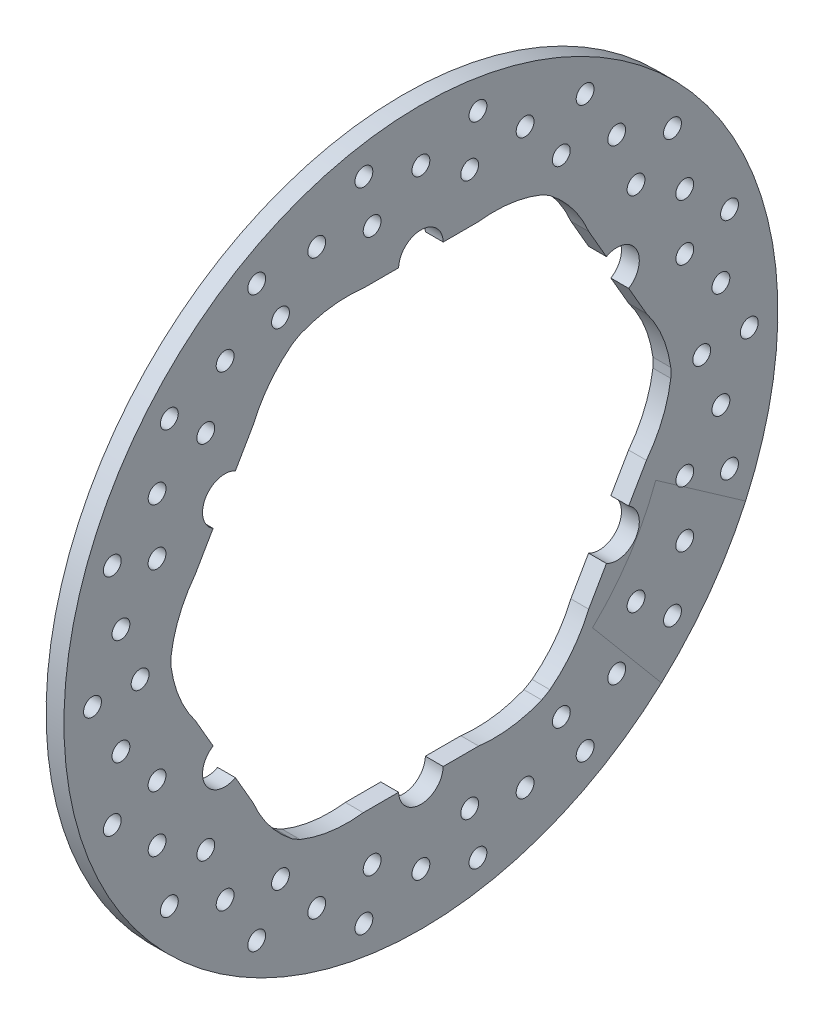
from build123d import *

# Parameters (mm, degrees)
SKETCH1_R           = 95.25
SKETCH1_R_2         = 66.675
MAIN_ROTOR_DEPTH    = 4.7625
SKETCH2_R           = 2.38125
CUT_SLOTS_DEPTH     = 135.788005424
BOSS_EXTRUDE2_START = -4.7625
BOSS_EXTRUDE2_DEPTH = 4.7625
SKETCH4_R           = 1.27
CUT_EXTRUDE2_DEPTH  = 135.788005424
FE12_CUT_OUT_DEPTH  = 4.7625
CIRPATTERN1_COUNT   = 6
SKETCH7_R           = 46.99
CLEANUP_CUT_DEPTH   = 135.788005424


with BuildPart() as part:
    # Sketch1 → Main Rotor (new body)
    with BuildSketch(Plane(origin=(0, 0, 0), x_dir=(0, 0, -1), z_dir=(1, 0, 0))):
        with Locations(Location((0, 0, 0), (0, 0, 180))):
            Circle(SKETCH1_R)
        with Locations(Location((0, 0, 0), (0, 0, 180))):
            Circle(SKETCH1_R_2, mode=Mode.SUBTRACT)
    extrude(amount=MAIN_ROTOR_DEPTH)

    # Sketch2 → Cut Slots (cut, through all)
    with BuildSketch(Plane(origin=(4.7625, 0, 0), x_dir=(0, 0, -1), z_dir=(1, 0, 0))):
        with Locations((-80.045174165, 14.114123881)):
            Circle(SKETCH2_R)
        with Locations((-82.345264359, 29.97122516)):
            Circle(SKETCH2_R)
        with Locations((-70.411168075, 25.627569339)):
            Circle(SKETCH2_R)
        with Locations((-70.39054482, 40.64)):
            Circle(SKETCH2_R)
        with Locations((-67.128474551, 56.327478237)):
            Circle(SKETCH2_R)
        with Locations((-57.399710123, 48.164075594)):
            Circle(SKETCH2_R)
        with Locations((-52.245776915, 62.264092337)):
            Circle(SKETCH2_R)
        with Locations((-87.63, 0)):
            Circle(SKETCH2_R)
        with Locations((-43.815, 75.889806134)):
            Circle(SKETCH2_R)
        with Locations((-37.465, 64.891283506)):
            Circle(SKETCH2_R)
        with Locations((-74.93, 0)):
            Circle(SKETCH2_R)
        with Locations((-27.79939725, 76.378216217)):
            Circle(SKETCH2_R)
        with Locations((-15.216789809, 86.298703396)):
            Circle(SKETCH2_R)
        with Locations((-13.011457953, 73.791644933)):
            Circle(SKETCH2_R)
        with Locations((0, 81.28)):
            Circle(SKETCH2_R)
        with Locations((15.216789809, 86.298703396)):
            Circle(SKETCH2_R)
        with Locations((13.011457953, 73.791644933)):
            Circle(SKETCH2_R)
        with Locations((27.79939725, 76.378216217)):
            Circle(SKETCH2_R)
        with Locations((43.815, 75.889806134)):
            Circle(SKETCH2_R)
        with Locations((37.465, 64.891283506)):
            Circle(SKETCH2_R)
        with Locations((52.245776915, 62.264092337)):
            Circle(SKETCH2_R)
        with Locations((67.128474551, 56.327478237)):
            Circle(SKETCH2_R)
        with Locations((57.399710123, 48.164075594)):
            Circle(SKETCH2_R)
        with Locations((70.39054482, 40.64)):
            Circle(SKETCH2_R)
        with Locations((82.345264359, 29.97122516)):
            Circle(SKETCH2_R)
        with Locations((70.411168075, 25.627569339)):
            Circle(SKETCH2_R)
        with Locations((80.045174165, 14.114123881)):
            Circle(SKETCH2_R)
        with Locations((87.63, 0)):
            Circle(SKETCH2_R)
        with Locations((74.93, 0)):
            Circle(SKETCH2_R)
        with Locations((80.045174165, -14.114123881)):
            Circle(SKETCH2_R)
        with Locations((82.345264359, -29.97122516)):
            Circle(SKETCH2_R)
        with Locations((70.411168075, -25.627569339)):
            Circle(SKETCH2_R)
        with Locations((70.39054482, -40.64)):
            Circle(SKETCH2_R)
        with Locations((67.128474551, -56.327478237)):
            Circle(SKETCH2_R)
        with Locations((57.399710123, -48.164075594)):
            Circle(SKETCH2_R)
        with Locations((52.245776915, -62.264092337)):
            Circle(SKETCH2_R)
        with Locations((43.815, -75.889806134)):
            Circle(SKETCH2_R)
        with Locations((37.465, -64.891283506)):
            Circle(SKETCH2_R)
        with Locations((27.79939725, -76.378216217)):
            Circle(SKETCH2_R)
        with Locations((15.216789809, -86.298703396)):
            Circle(SKETCH2_R)
        with Locations((13.011457953, -73.791644933)):
            Circle(SKETCH2_R)
        with Locations((0, -81.28)):
            Circle(SKETCH2_R)
        with Locations((-15.216789809, -86.298703396)):
            Circle(SKETCH2_R)
        with Locations((-13.011457953, -73.791644933)):
            Circle(SKETCH2_R)
        with Locations((-27.79939725, -76.378216217)):
            Circle(SKETCH2_R)
        with Locations((-43.815, -75.889806134)):
            Circle(SKETCH2_R)
        with Locations((-37.465, -64.891283506)):
            Circle(SKETCH2_R)
        with Locations((-52.245776915, -62.264092337)):
            Circle(SKETCH2_R)
        with Locations((-67.128474551, -56.327478237)):
            Circle(SKETCH2_R)
        with Locations((-57.399710123, -48.164075594)):
            Circle(SKETCH2_R)
        with Locations((-70.39054482, -40.64)):
            Circle(SKETCH2_R)
        with Locations((-82.345264359, -29.97122516)):
            Circle(SKETCH2_R)
        with Locations((-70.411168075, -25.627569339)):
            Circle(SKETCH2_R)
        with Locations((-80.045174165, -14.114123881)):
            Circle(SKETCH2_R)
    extrude(amount=-CUT_SLOTS_DEPTH, mode=Mode.SUBTRACT)

    # Sketch3 → Boss-Extrude2 (add)
    with BuildSketch(Plane(origin=(4.7625, 0, 0), x_dir=(0, 0, -1), z_dir=(1, 0, 0)).offset(BOSS_EXTRUDE2_START)):
        with BuildLine():
            ThreePointArc((15.226370254, -60.56863172), (10.49630902, -58.039692226), (8.604258147, -53.0208121))
            ThreePointArc((8.604258147, -53.0208121), (11.546477683, -42.011879168), (19.60245, -33.952439353))
            ThreePointArc((19.60245, -33.952439353), (30.610115778, -31.005482581), (41.615241134, -33.961912186))
            ThreePointArc((41.615241134, -33.961912186), (45.015693386, -38.109916371), (44.840788615, -43.470739307))
            ThreePointArc((44.840788615, -43.470739307), (40.527102575, -50.964468228), (34.431304095, -57.096768064))
            ThreePointArc((34.431304095, -57.096768064), (57.742243797, -33.3375), (66.662903665, -1.27))
            ThreePointArc((66.662903665, -1.27), (64.400075463, -9.615266258), (60.067158869, -17.097892412))
            ThreePointArc((60.067158869, -17.097892412), (55.512002406, -19.929775856), (50.219499281, -19.058899914))
            ThreePointArc((50.219499281, -19.058899914), (42.156593461, -11.006396586), (39.2049, 0))
            ThreePointArc((39.2049, 0), (42.156593461, 11.006396586), (50.219499281, 19.058899914))
            ThreePointArc((50.219499281, 19.058899914), (55.512002406, 19.929775856), (60.067158869, 17.097892412))
            ThreePointArc((60.067158869, 17.097892412), (64.400075463, 9.615266258), (66.662903665, 1.27))
            ThreePointArc((66.662903665, 1.27), (57.742243797, 33.3375), (34.431304095, 57.096768064))
            ThreePointArc((34.431304095, 57.096768064), (40.527102575, 50.964468228), (44.840788615, 43.470739307))
            ThreePointArc((44.840788615, 43.470739307), (45.015693386, 38.109916371), (41.615241134, 33.961912186))
            ThreePointArc((41.615241134, 33.961912186), (30.610115778, 31.005482581), (19.60245, 33.952439353))
            ThreePointArc((19.60245, 33.952439353), (11.546477683, 42.011879168), (8.604258147, 53.0208121))
            ThreePointArc((8.604258147, 53.0208121), (10.49630902, 58.039692226), (15.226370254, 60.56863172))
            ThreePointArc((15.226370254, 60.56863172), (23.872972888, 60.579734486), (32.23159957, 58.366768064))
            ThreePointArc((32.23159957, 58.366768064), (0, 66.675), (-32.23159957, 58.366768064))
            ThreePointArc((-32.23159957, 58.366768064), (-23.872972888, 60.579734486), (-15.226370254, 60.56863172))
            ThreePointArc((-15.226370254, 60.56863172), (-10.49630902, 58.039692226), (-8.604258147, 53.0208121))
            ThreePointArc((-8.604258147, 53.0208121), (-11.546477683, 42.011879168), (-19.60245, 33.952439353))
            ThreePointArc((-19.60245, 33.952439353), (-30.610115778, 31.005482581), (-41.615241134, 33.961912186))
            ThreePointArc((-41.615241134, 33.961912186), (-45.015693386, 38.109916371), (-44.840788615, 43.470739307))
            ThreePointArc((-44.840788615, 43.470739307), (-40.527102575, 50.964468228), (-34.431304095, 57.096768064))
            ThreePointArc((-34.431304095, 57.096768064), (-57.742243797, 33.3375), (-66.662903665, 1.27))
            ThreePointArc((-66.662903665, 1.27), (-64.400075463, 9.615266258), (-60.067158869, 17.097892412))
            ThreePointArc((-60.067158869, 17.097892412), (-55.512002406, 19.929775856), (-50.219499281, 19.058899914))
            ThreePointArc((-50.219499281, 19.058899914), (-42.156593461, 11.006396586), (-39.2049, 0))
            ThreePointArc((-39.2049, 0), (-42.156593461, -11.006396586), (-50.219499281, -19.058899914))
            ThreePointArc((-50.219499281, -19.058899914), (-55.512002406, -19.929775856), (-60.067158869, -17.097892412))
            ThreePointArc((-60.067158869, -17.097892412), (-64.400075463, -9.615266258), (-66.662903665, -1.27))
            ThreePointArc((-66.662903665, -1.27), (-57.742243797, -33.3375), (-34.431304095, -57.096768064))
            ThreePointArc((-34.431304095, -57.096768064), (-40.527102575, -50.964468228), (-44.840788615, -43.470739307))
            ThreePointArc((-44.840788615, -43.470739307), (-45.015693386, -38.109916371), (-41.615241134, -33.961912186))
            ThreePointArc((-41.615241134, -33.961912186), (-30.610115778, -31.005482581), (-19.60245, -33.952439353))
            ThreePointArc((-19.60245, -33.952439353), (-11.546477683, -42.011879168), (-8.604258147, -53.0208121))
            ThreePointArc((-8.604258147, -53.0208121), (-10.49630902, -58.039692226), (-15.226370254, -60.56863172))
            ThreePointArc((-15.226370254, -60.56863172), (-23.872972888, -60.579734486), (-32.23159957, -58.366768064))
            ThreePointArc((-32.23159957, -58.366768064), (0, -66.675), (32.23159957, -58.366768064))
            ThreePointArc((32.23159957, -58.366768064), (23.872972888, -60.579734486), (15.226370254, -60.56863172))
        make_face()
        with BuildLine():
            Line((-16.8148, 11.541116411), (-1.5875, 20.332602165))
            ThreePointArc((-1.5875, 20.332602165), (0, 21.920102165), (1.5875, 20.332602165))
            Line((1.5875, 20.332602165), (16.8148, 11.541116411))
            ThreePointArc((16.8148, 11.541116411), (18.4023, 11.541116411), (19.19605, 10.166301083))
            ThreePointArc((19.19605, 10.166301083), (18.983365329, 9.372551083), (18.4023, 8.791485754))
            Line((18.4023, 8.791485754), (18.4023, -8.791485754))
            ThreePointArc((18.4023, -8.791485754), (18.983365329, -9.372551083), (19.19605, -10.166301083))
            ThreePointArc((19.19605, -10.166301083), (18.4023, -11.541116411), (16.8148, -11.541116411))
            Line((16.8148, -11.541116411), (1.5875, -20.332602165))
            ThreePointArc((1.5875, -20.332602165), (0, -21.920102165), (-1.5875, -20.332602165))
            Line((-1.5875, -20.332602165), (-16.8148, -11.541116411))
            ThreePointArc((-16.8148, -11.541116411), (-18.983365329, -10.960051083), (-18.4023, -8.791485754))
            Line((-18.4023, -8.791485754), (-18.4023, 8.791485754))
            ThreePointArc((-18.4023, 8.791485754), (-18.983365329, 10.960051083), (-16.8148, 11.541116411))
        make_face(mode=Mode.SUBTRACT)
    extrude(amount=BOSS_EXTRUDE2_DEPTH)

    # Sketch4 → Cut-Extrude2 (cut, through all)
    with BuildSketch(Plane.ZY):
        with Locations((0, 45.212)):
            Circle(SKETCH4_R)
        with Locations((39.154740556, 22.606)):
            Circle(SKETCH4_R)
        with Locations((39.154740556, -22.606)):
            Circle(SKETCH4_R)
        with Locations((0, -45.212)):
            Circle(SKETCH4_R)
        with Locations((-39.154740556, -22.606)):
            Circle(SKETCH4_R)
        with Locations((-39.154740556, 22.606)):
            Circle(SKETCH4_R)
    extrude(amount=-CUT_EXTRUDE2_DEPTH, mode=Mode.SUBTRACT)

    # Sketch6 → FE12 Cut OUt (cut)
    with BuildSketch(Plane(origin=(4.7625, 0, 0), x_dir=(0, 0, -1), z_dir=(1, 0, 0))):
        with BuildLine():
            Line((-18.4023, 60.5917), (-5.950469261, 60.5917))
            ThreePointArc((-5.950469261, 60.5917), (0, 66.367025), (5.950469261, 60.5917))
            Line((5.950469261, 60.5917), (18.4023, 60.5917))
            Line((18.4023, 60.5917), (18.4023, 35.1917))
            Line((18.4023, 35.1917), (-18.4023, 35.1917))
            Line((-18.4023, 35.1917), (-18.4023, 60.5917))
        make_face()
    fe12_cut_out = extrude(amount=-FE12_CUT_OUT_DEPTH, mode=Mode.SUBTRACT)

    # CirPattern1: FE12 Cut OUt ×6 about axis
    cirpattern1_axis = Axis((0, 0, 0), (1, 0, 0))
    for i in range(1, CIRPATTERN1_COUNT):
        add(fe12_cut_out.rotate(cirpattern1_axis, i * 360 / CIRPATTERN1_COUNT), mode=Mode.SUBTRACT)

    # Sketch7 → Cleanup Cut (cut, through all)
    with BuildSketch(Plane(origin=(4.7625, 0, 0), x_dir=(0, 0, -1), z_dir=(1, 0, 0))):
        Circle(SKETCH7_R)
    extrude(amount=-CLEANUP_CUT_DEPTH, mode=Mode.SUBTRACT)


solid = part.part
